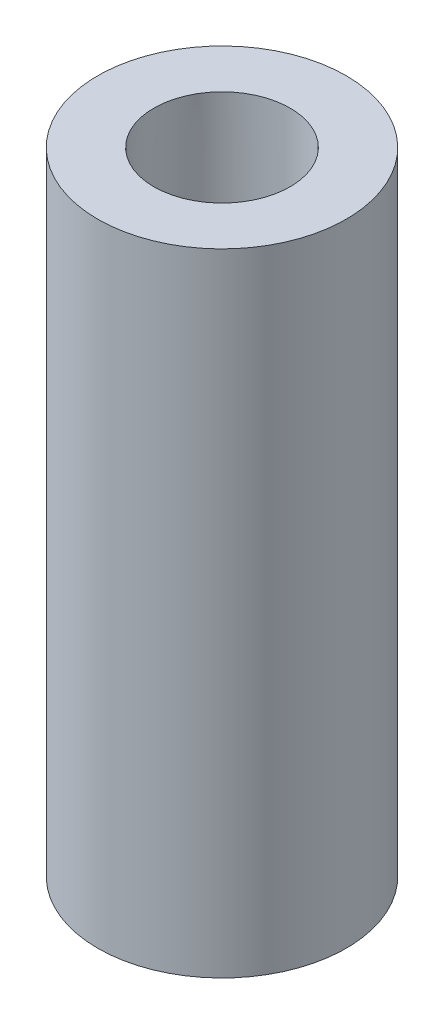
from build123d import *

# Parameters (mm, degrees)
ESQUISSE2_R             = 2
ENL_V_MAT_EXTRU_1_DEPTH = 23.134437673


with BuildPart() as part:
    # Esquisse1 → Révolution1 (revolve)
    with BuildSketch(Plane.XY, mode=Mode.PRIVATE) as r_volution1_sk:
        Polygon((-2.495, -19.585017995), (-2.495, 0), (-4.146462722, 0), (-4, 17.466969529), (-7.292475615, 17.466969529), (-7.292475615, -19.585017995), align=None)
    revolve(r_volution1_sk.sketch.rotate(Axis((0, 0, 0), (0, -1, 0)), 270), axis=Axis((0, 0, 0), (0, -1, 0)))

    # Esquisse2 → Enlèv. mat.-Extru.1 (cut, through all)
    with BuildSketch(Plane.XY):
        with Locations(Location((0, 8.733484764, 0), (0, 0, 90))):
            Circle(ESQUISSE2_R)
        with Locations((0, -9.792508998)):
            Circle(ESQUISSE2_R)
    extrude(amount=-ENL_V_MAT_EXTRU_1_DEPTH, mode=Mode.SUBTRACT)


solid = part.part
